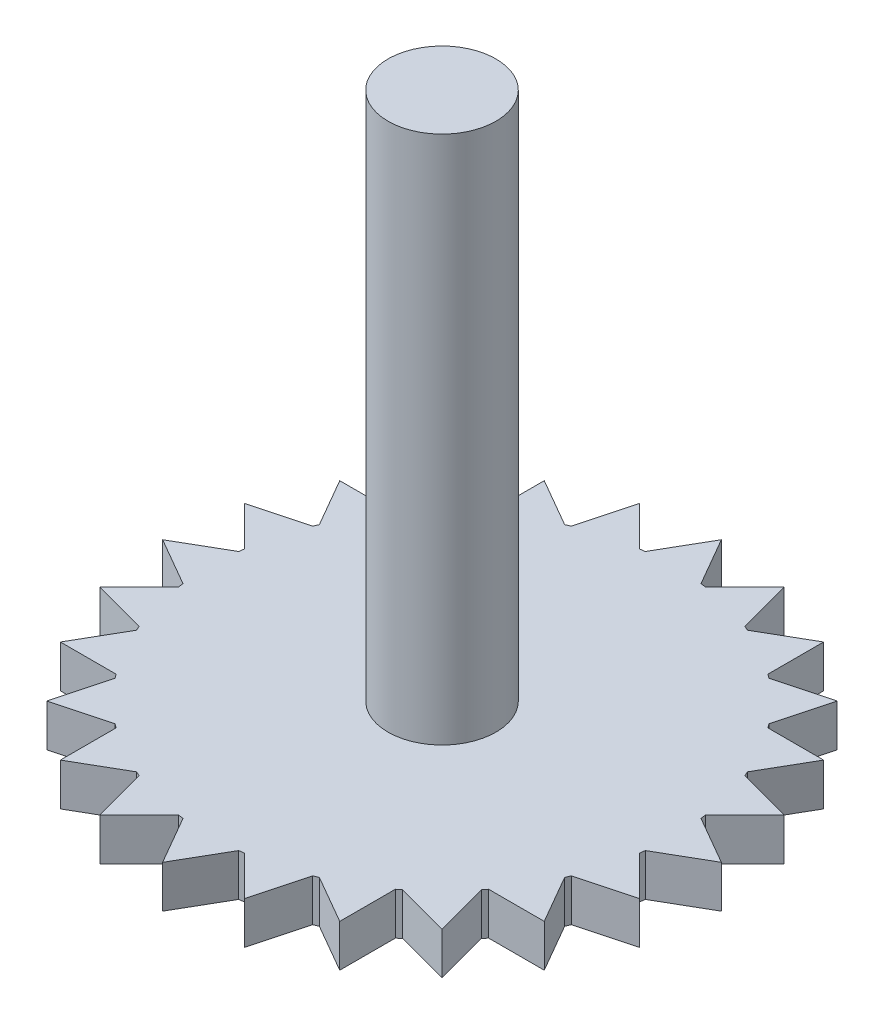
from build123d import *

# Parameters (mm, degrees)
SKETCH1_R           = 13.97
BOSS_EXTRUDE1_DEPTH = 2.54
BOSS_EXTRUDE2_DEPTH = 2.54
CIRPATTERN1_COUNT   = 24
SKETCH3_R           = 3.2385
BOSS_EXTRUDE3_DEPTH = 31.75


with BuildPart() as part:
    # Sketch1 → Boss-Extrude1 (new body)
    with BuildSketch(Plane(origin=(0, 0, 0), x_dir=(1, 0, 0), z_dir=(0, 1, 0))):
        Circle(SKETCH1_R)
    extrude(amount=BOSS_EXTRUDE1_DEPTH)

    # Sketch2 → Boss-Extrude2 (add)
    with BuildSketch(Plane(origin=(0, 2.54, 0), x_dir=(1, 0, 0), z_dir=(0, 1, 0))):
        Polygon((0, -16.764), (3.64730005, -10.446691002), (-3.581879589, -10.560002566), align=None)
    boss_extrude2 = extrude(amount=-BOSS_EXTRUDE2_DEPTH)

    # CirPattern1: Boss-Extrude2 ×24 about axis
    cirpattern1_axis = Axis((0, 2.667, 0), (0, -1, 0))
    for i in range(1, CIRPATTERN1_COUNT):
        add(boss_extrude2.rotate(cirpattern1_axis, i * 360 / CIRPATTERN1_COUNT))

    # Sketch3 → Boss-Extrude3 (add)
    with BuildSketch(Plane(origin=(0, 2.54, 0), x_dir=(1, 0, 0), z_dir=(0, 1, 0))):
        Circle(SKETCH3_R)
    extrude(amount=BOSS_EXTRUDE3_DEPTH)


solid = part.part
